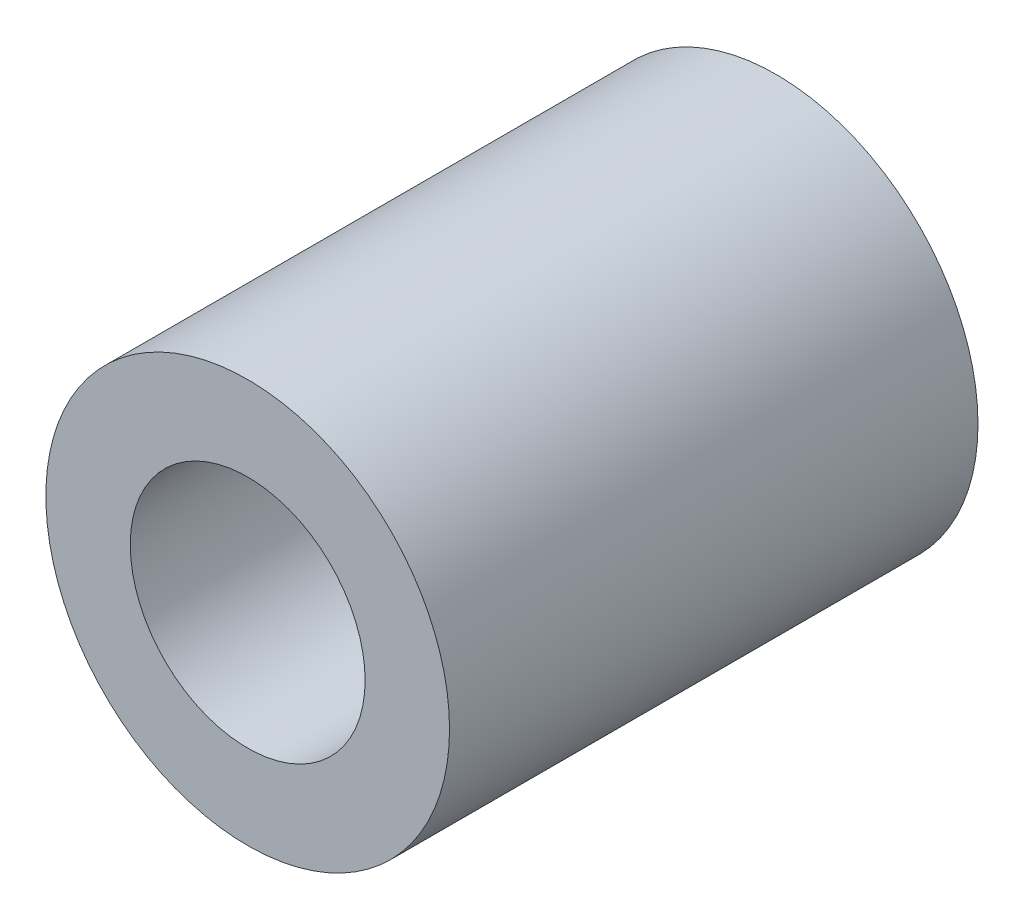
from build123d import *

# Parameters (mm, degrees)
SKETCH_1_R      = 2.75
SKETCH_1_R_2    = 1.6
EXTRUDE_1_DEPTH = 7.2


with BuildPart() as part:
    # ｽｹｯﾁ1 → ﾎﾞｽ - 押し出し1 (new body)
    with BuildSketch(Plane.XY):
        Circle(SKETCH_1_R)
        Circle(SKETCH_1_R_2, mode=Mode.SUBTRACT)
    extrude(amount=EXTRUDE_1_DEPTH)


solid = part.part
